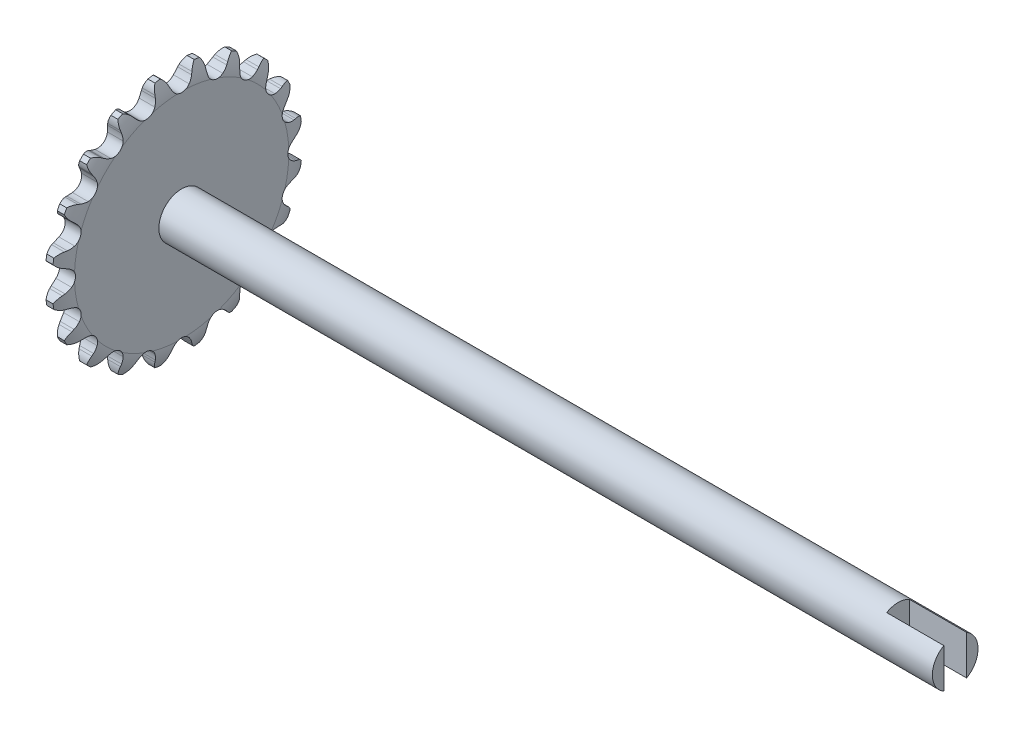
from build123d import *
from build123d.topology import SkipClean

# Parameters (mm, degrees)
TOOTHCUT_DEPTH      = 32.169679271
TEETHCUTS_COUNT     = 20
TEETHCUTS_ANGLE     = 342
BORSKE_R            = 4
BORE_DEPTH          = 50.8000508
BOSS_EXTRUDE1_START = -201
SKETCH1_R           = 4
BOSS_EXTRUDE1_DEPTH = 201
BOSS_EXTRUDE2_START = 10
BOSS_EXTRUDE2_DEPTH = 10


with BuildPart() as part:
    # BasProSke → Base-Revolve (revolve)
    with BuildSketch(Plane(origin=(0, 0, 0), x_dir=(1, 0, 0), z_dir=(0, 1, 0)), mode=Mode.PRIVATE) as base_revolve_sk:
        with BuildLine():
            Line((0, 0), (0, 18.776161082))
            ThreePointArc((0, 18.776161082), (0.199787117, 20.411751477), (0.7874, 21.951161082))
            Line((0.7874, 21.951161082), (2.01295, 21.951161082))
            ThreePointArc((2.01295, 21.951161082), (2.600562883, 20.411751477), (2.80035, 18.776161082))
            Line((2.80035, 18.776161082), (2.80035, 0))
            Line((2.80035, 0), (0, 0))
        make_face()
    revolve(base_revolve_sk.sketch.rotate(Axis((-10, 0, 0), (1, 0, 0)), 180), axis=Axis((-10, 0, 0), (1, 0, 0)))

    # TooCutSke → ToothCut (cut, through all)
    with BuildSketch(Plane(origin=(0, 0, 0), x_dir=(0, 0, -1), z_dir=(1, 0, 0))):
        with BuildLine():
            Line((1.918313524, 20.240957663), (2.077231161, 20.619007781))
            ThreePointArc((2.077231161, 20.619007781), (3.071954195, 21.821421376), (4.565885661, 22.272465878))
            ThreePointArc((4.565885661, 22.272465878), (0, 22.735655877), (-4.565885661, 22.272465878))
            ThreePointArc((-4.565885661, 22.272465878), (-3.071954195, 21.821421376), (-2.077231161, 20.619007781))
            Line((-2.077231161, 20.619007781), (-1.918313524, 20.240957663))
            ThreePointArc((-1.918313524, 20.240957663), (-1.660798791, 19.726712623), (-1.337533993, 19.251042918))
            ThreePointArc((-1.337533993, 19.251042918), (0, 18.598684001), (1.337533993, 19.251042918))
            ThreePointArc((1.337533993, 19.251042918), (1.660798791, 19.726712623), (1.918313524, 20.240957663))
        make_face()
    toothcut = extrude(amount=TOOTHCUT_DEPTH, mode=Mode.SUBTRACT)

    # TeethCuts: ToothCut ×20 about axis
    teethcuts_axis = Axis((-10, 0, 0), (1, 0, 0))
    for i in range(1, TEETHCUTS_COUNT):
        add(toothcut.rotate(teethcuts_axis, i * TEETHCUTS_ANGLE / (TEETHCUTS_COUNT - 1)), mode=Mode.SUBTRACT)

    # BorSke → Bore (cut, symmetric)
    with BuildSketch(Plane(origin=(0, 0, 0), x_dir=(0, 0, -1), z_dir=(1, 0, 0))):
        with Locations(Location((0, 0, 0), (0, 0, 180))):
            Circle(BORSKE_R)
    extrude(amount=BORE_DEPTH, both=True, mode=Mode.SUBTRACT)

    # Sketch1 → Boss-Extrude1 (add)
    with BuildSketch(Plane.ZY.offset(BOSS_EXTRUDE1_START)):
        Circle(SKETCH1_R)
    extrude(amount=BOSS_EXTRUDE1_DEPTH)

    # Split1
    split(bisect_by=Plane(origin=(128.30035, 0, 0), x_dir=(0, 0, 1), z_dir=(1, 0, 0)), keep=Keep.BOTTOM)

    # Sketch3 → Boss-Extrude2 (add)
    with SkipClean():  # the faces are left unmerged after this step: merging them gives an invalid solid
        with BuildSketch(Plane(origin=(128.30035, 0, 0), x_dir=(0, 0, -1), z_dir=(1, 0, 0)).offset(BOSS_EXTRUDE2_START)):
            with BuildLine():
                Line((2, 3.464101615), (2, -3.464101615))
                ThreePointArc((2, -3.464101615), (4, 0), (2, 3.464101615))
            make_face()
            with BuildLine():
                Line((-2, -3.464101615), (-2, 3.464101615))
                ThreePointArc((-2, 3.464101615), (-4, 0), (-2, -3.464101615))
            make_face()
        extrude(amount=-BOSS_EXTRUDE2_DEPTH)


solid = part.part
